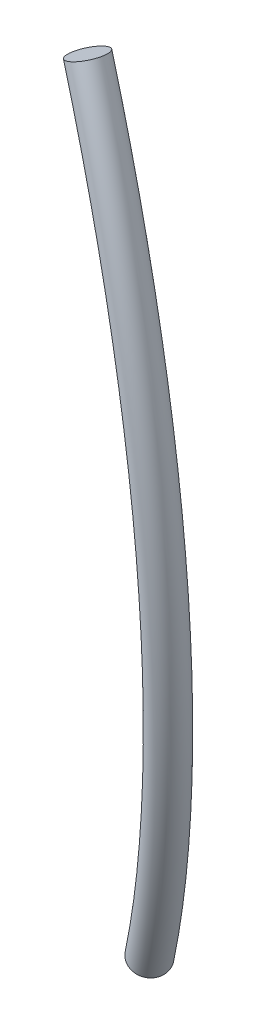
from build123d import *

# Parameters (mm, degrees)
SKETCH3_R = 50.8


with BuildPart() as part:
    # Sweep1: sweep along a path in Sketch2
    with BuildLine(Plane(origin=(7284.240162706, 1208.744225225, -16012.329511346), x_dir=(0.9104065059380377, -0.05563022650703536, 0.40995764640322274), z_dir=(-0.4131072153859329, -0.06855086458476153, 0.9080986772156219))) as sweep1_path:
        ThreePointArc((-139.264740832, -3617.106819122), (85.035608486, -2428.043974995), (-201.206089632, -1252.354056587))
    # Sketch3 → Sweep1 (sweep)
    with BuildSketch(Plane(origin=(-1268.119770499, -3035.436332986, -806.026074643), x_dir=(-0.9272634921207171, 0.36186887869772266, 0.09609022224006901), z_dir=(0.37440942319884657, 0.8962055422757111, 0.2379773304628106))):
        with Locations((-8999.055618983, -15217.229990651)):
            Circle(SKETCH3_R)
    sweep(path=sweep1_path.line)


solid = part.part
